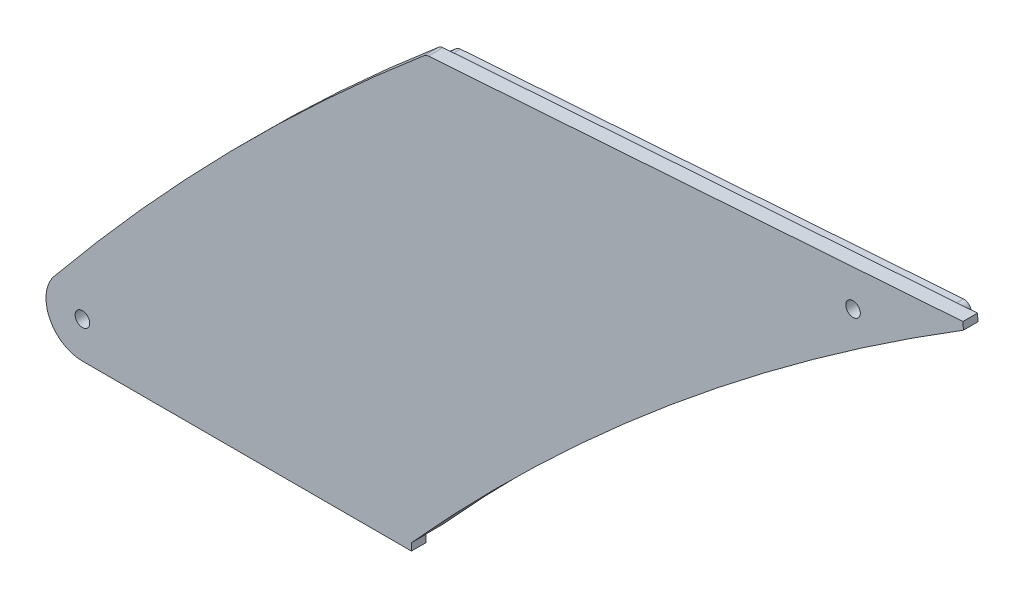
from build123d import *

# Parameters (mm, degrees)
BOSS_EXTRUDE2_DEPTH = 2
SKETCH7_R           = 1
BOSS_EXTRUDE3_DEPTH = 2
FILLET1_R           = 2


with BuildPart() as part:
    # Sketch6 → Boss-Extrude2 (new body)
    with BuildSketch(Plane.XY.offset(2)):
        with BuildLine():
            Line((-47.16876351, -59), (-2.443648629, -59))
            ThreePointArc((-2.443648629, -59), (-2.038405947, -58.914209149), (-1.702695493, -58.671556736))
            ThreePointArc((-1.702695493, -58.671556736), (32.301028127, -25.886609728), (70.398776732, 2.035917408))
            ThreePointArc((70.398776732, 2.035917408), (70.813266743, 3.192601161), (69.793484422, 3.877993962))
            Line((69.793484422, 3.877993962), (0.723267865, -0.951866082))
            ThreePointArc((0.723267865, -0.951866082), (0.415830952, -1.023295613), (0.145969905, -1.186986325))
            ThreePointArc((0.145969905, -1.186986325), (-26.215640884, -25.687788129), (-50.262327585, -52.46428288))
            ThreePointArc((-50.262327585, -52.46428288), (-50.784207361, -56.711305279), (-47.16876351, -59))
        make_face()
        with BuildLine():
            Line((-47.16876351, -58), (-2.443648629, -58))
            ThreePointArc((-2.443648629, -58), (31.656951696, -25.121648584), (69.863240895, 2.880429912))
            Line((69.863240895, 2.880429912), (0.793024339, -1.949430132))
            ThreePointArc((0.793024339, -1.949430132), (-25.502517251, -26.388826418), (-49.488936566, -53.09821216))
            ThreePointArc((-49.488936566, -53.09821216), (-49.880346398, -56.28347896), (-47.16876351, -58))
        make_face(mode=Mode.SUBTRACT)
    extrude(amount=BOSS_EXTRUDE2_DEPTH)

    # Sketch7 → Boss-Extrude3 (add)
    with BuildSketch(Plane.XY.offset(4)):
        with BuildLine():
            Line((73.71668331, 5.154772651), (0.326528995, 0.022833132))
            ThreePointArc((0.326528995, 0.022833132), (0.019473004, -0.048441349), (-0.250141607, -0.211755142))
            ThreePointArc((-0.250141607, -0.211755142), (-26.813414366, -24.869459397), (-51.035718603, -51.8303536))
            ThreePointArc((-51.035718603, -51.8303536), (-51.688068324, -57.139131599), (-47.16876351, -60))
            Line((-47.16876351, -60), (-2, -60))
            Line((-2, -60), (-2, -59))
            ThreePointArc((-2, -59), (33.663262979, -24.745525454), (73.786439783, 4.157208601))
            Line((73.786439783, 4.157208601), (73.71668331, 5.154772651))
        make_face()
        with Locations((58.629217017, -0.912455258)):
            Circle(SKETCH7_R, mode=Mode.SUBTRACT)
        with Locations((-47.16876351, -55)):
            Circle(SKETCH7_R, mode=Mode.SUBTRACT)
    extrude(amount=BOSS_EXTRUDE3_DEPTH)

    # Fillet1
    fillet1_edges = [part.edges().sort_by_distance(p)[0] for p in [
        (69.863240895, 2.880429912, 3),
        (0.793024339, -1.949430132, 3),
        (-2.443648629, -58, 3),
    ]]
    fillet(fillet1_edges, radius=FILLET1_R)


solid = part.part
